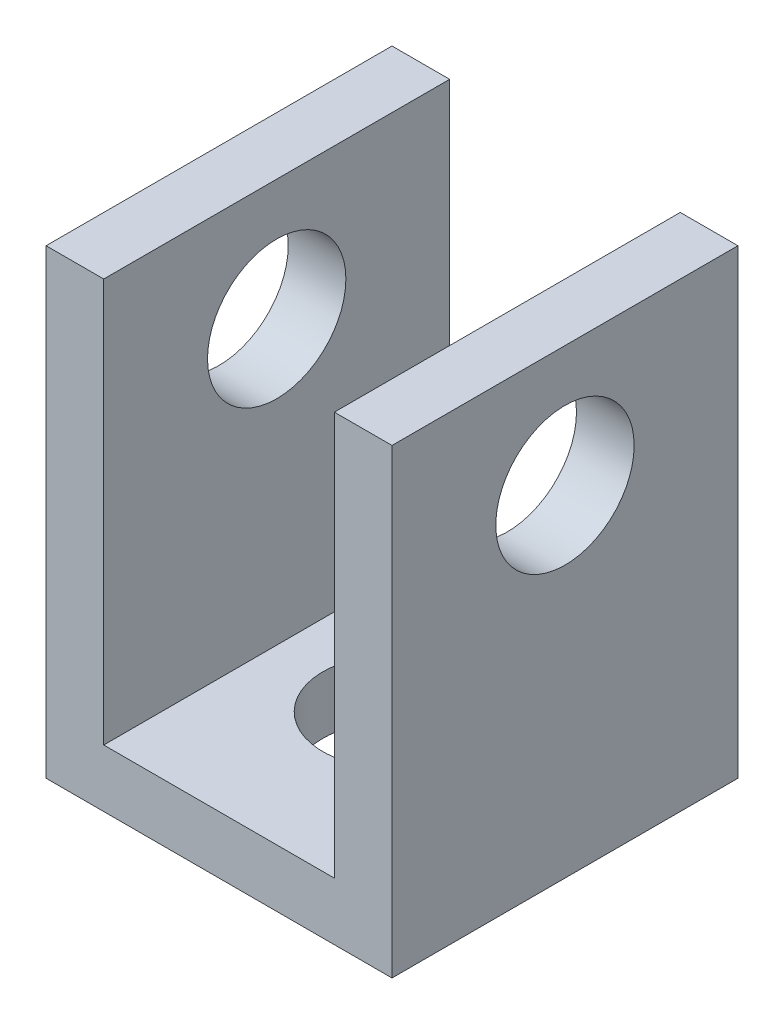
from build123d import *

# Parameters (mm, degrees)
BOSS_EXTRUDE1_DEPTH = 15
SKETCH2_R           = 3
CUT_EXTRUDE1_DEPTH  = 17
SKETCH3_R           = 3
CUT_EXTRUDE2_DEPTH  = 17


with BuildPart() as part:
    # Sketch1 → Boss-Extrude1 (new body)
    with BuildSketch(Plane.XY):
        Polygon((-30.175322727, 12.351876728), (-30.175322727, -7.648123272), (-15.175322727, -7.648123272), (-15.175322727, 12.351876728), (-17.675322727, 12.351876728), (-17.675322727, -5.148123272), (-27.675322727, -5.148123272), (-27.675322727, 12.351876728), align=None)
    extrude(amount=BOSS_EXTRUDE1_DEPTH)

    # Sketch2 → Cut-Extrude1 (cut)
    with BuildSketch(Plane(origin=(-15.175322727, 0, 0), x_dir=(0, 0, -1), z_dir=(1, 0, 0))):
        with Locations((-7.5, 7.104053692)):
            Circle(SKETCH2_R)
    extrude(amount=-CUT_EXTRUDE1_DEPTH, mode=Mode.SUBTRACT)

    # Sketch3 → Cut-Extrude2 (cut)
    with BuildSketch(Plane(origin=(0, -7.648123272, 0), x_dir=(-1, 0, 0), z_dir=(0, -1, 0))):
        with Locations(Location((22.675322727, -7.5, 0), (0, 0, 90))):
            Circle(SKETCH3_R)
    extrude(amount=-CUT_EXTRUDE2_DEPTH, mode=Mode.SUBTRACT)


solid = part.part
